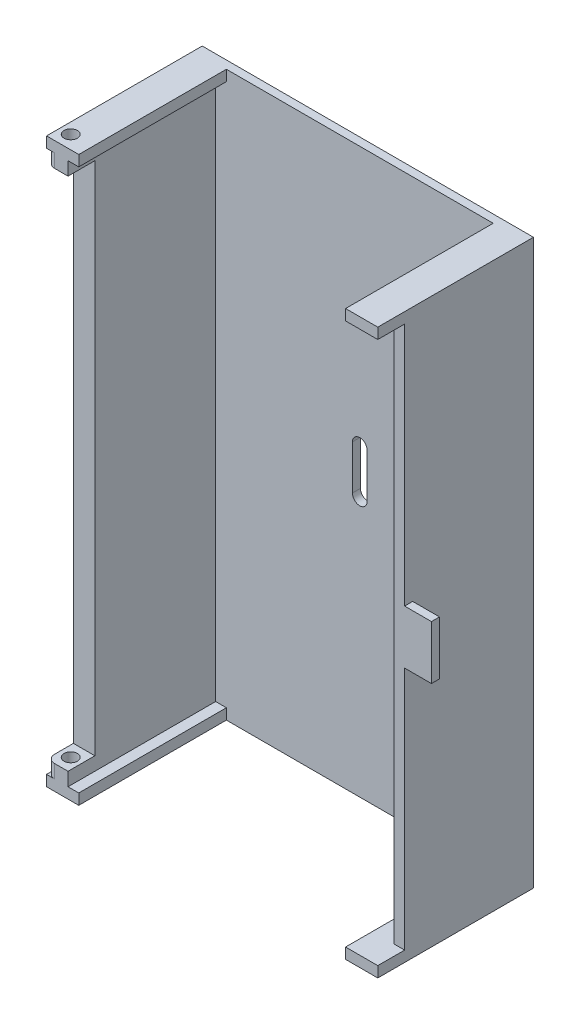
from build123d import *

# Parameters (mm, degrees)
SKETCH_2_W               = 123.4
SKETCH_2_H               = 210
EXTRUDE_2_DEPTH          = 3
EXTRUDE_5_DEPTH          = 4
EXTRUDE_START            = -4
EXTRUDE_6_DEPTH          = 4
EXTRUDE_8_DEPTH          = 8
CUT_EXTRUDE_1_DEPTH      = 205
CUT_EXTRUDE_1_DEPTH_BACK = 243.711170942
SKETCH_8_R               = 2.5
FILLET_1_R               = 3
SKETCH_10_W              = 4
SKETCH_10_H              = 202
EXTRUDE_9_DEPTH          = 45
CUT_EXTRUDE_2_DEPTH      = 182.404830421
SKETCH_12_W              = 3
SKETCH_12_H              = 20
EXTRUDE_10_DEPTH         = 10
CUT_EXTRUDE_3_REACH      = 254.984
SKETCH_13_W              = 99.4
SKETCH_13_H              = 144.727282118
SKETCH_13_W_2            = 205.501958082
SKETCH_13_H_2            = 63.361365512


with BuildPart() as part:
    # 草圖2 → 填料-伸長2 (new body)
    with BuildSketch(Plane.XY):
        with Locations((2.95, -15)):
            Rectangle(SKETCH_2_W, SKETCH_2_H)
    extrude(amount=EXTRUDE_2_DEPTH)

    # 草圖4 → 填料-伸長5 (add)
    with BuildSketch(Plane.XZ.offset(120)):
        with BuildLine():
            Line((-58.75, 3), (-58.75, 58))
            ThreePointArc((-58.75, 58), (2.95, 119.7), (64.65, 58))
            Line((64.65, 58), (64.65, 3))
            Line((64.65, 3), (-58.75, 3))
        make_face()
    extrude(amount=-EXTRUDE_5_DEPTH)

    # 草圖5 → 填料-伸長6 (add)
    with BuildSketch(Plane(origin=(0, 90, 0), x_dir=(1, 0, 0), z_dir=(0, 1, 0)).offset(EXTRUDE_START)):
        with BuildLine():
            Line((-58.75, -3), (-58.75, -58))
            ThreePointArc((-58.75, -58), (2.95, -119.7), (64.65, -58))
            Line((64.65, -58), (64.65, -3))
            Line((64.65, -3), (-58.75, -3))
        make_face()
    extrude(amount=EXTRUDE_6_DEPTH)

    # 草圖7 → 填料-伸長8 (add)
    with BuildSketch(Plane.ZY.offset(58.75)):
        Polygon((3, 86), (58, 86), (58, 81), (48, 81), (48, -111), (58, -111), (58, -116), (3, -116), align=None)
    extrude(amount=-EXTRUDE_8_DEPTH)

    # 草圖8 → 除料-伸長1 (cut, two sides: drawn at the far end of the back side and taken through both)
    with BuildSketch(Plane.XZ.offset(-81).offset(-CUT_EXTRUDE_1_DEPTH_BACK)):
        with Locations(Location((-54.75, 53, 0), (0, 0, 90))):
            Circle(SKETCH_8_R)
    extrude(amount=CUT_EXTRUDE_1_DEPTH + CUT_EXTRUDE_1_DEPTH_BACK, mode=Mode.SUBTRACT)

    # 圓角1
    fillet_1_edges = [part.edges().sort_by_distance(p)[0] for p in [
        (-58.75, -113.5, 58),
        (-58.75, 83.5, 58),
    ]]
    fillet(fillet_1_edges, radius=FILLET_1_R)

    # 草圖10 → 填料-伸長9 (add)
    with BuildSketch(Plane.XY.offset(3)):
        with Locations((62.65, -15)):
            Rectangle(SKETCH_10_W, SKETCH_10_H)
    extrude(amount=EXTRUDE_9_DEPTH)

    # 草圖11 → 除料-伸長2 (cut, through all)
    with BuildSketch(Plane(origin=(0, 0, 0), x_dir=(-1, 0, 0), z_dir=(0, 0, -1))):
        with BuildLine():
            Line((-0.2, -6.75), (-0.2, -23.25))
            ThreePointArc((-0.2, -23.25), (-2.95, -26), (-5.7, -23.25))
            Line((-5.7, -23.25), (-5.7, -6.75))
            ThreePointArc((-5.7, -6.75), (-2.95, -4), (-0.2, -6.75))
        make_face()
    extrude(amount=-CUT_EXTRUDE_2_DEPTH, mode=Mode.SUBTRACT)

    # 草圖12 → 填料-伸長10 (add)
    with BuildSketch(Plane(origin=(64.65, 0, 0), x_dir=(0, 0, -1), z_dir=(1, 0, 0))):
        with Locations((-46.5, -15)):
            Rectangle(SKETCH_12_W, SKETCH_12_H)
    extrude(amount=EXTRUDE_10_DEPTH)

    # 除料-伸長3: up to this face of the body (flat: up to its plane)
    cut_extrude_3_end = Plane(part.part.faces().sort_by_distance((3.036368919, -120, 54.121907078))[0])
    # 草圖13 → 除料-伸長3 (cut, up to the picked face)
    with BuildSketch(Plane(origin=(0, 90, 0), x_dir=(1, 0, 0), z_dir=(0, 1, 0)), mode=Mode.PRIVATE) as cut_extrude_3_sk1:
        with Locations((2.95, -75.363641059)):
            Rectangle(SKETCH_13_W, SKETCH_13_H)
    cut_extrude_3_tool1 = split(extrude(cut_extrude_3_sk1.sketch, amount=-CUT_EXTRUDE_3_REACH, mode=Mode.PRIVATE), bisect_by=cut_extrude_3_end, keep=Keep.BOTH, mode=Mode.PRIVATE)
    # 草圖13 → 除料-伸長3 (cut, up to the picked face)
    with BuildSketch(Plane(origin=(0, 90, 0), x_dir=(1, 0, 0), z_dir=(0, 1, 0)), mode=Mode.PRIVATE) as cut_extrude_3_sk2:
        with Locations((2.95, -89.680682756)):
            Rectangle(SKETCH_13_W_2, SKETCH_13_H_2)
    cut_extrude_3_tool2 = split(extrude(cut_extrude_3_sk2.sketch, amount=-CUT_EXTRUDE_3_REACH, mode=Mode.PRIVATE), bisect_by=cut_extrude_3_end, keep=Keep.BOTH, mode=Mode.PRIVATE)
    add(cut_extrude_3_tool1.solids().sort_by(Axis((2.95, 90, 75.363641), (0, -1, 0)))[0], mode=Mode.SUBTRACT)
    add(cut_extrude_3_tool2.solids().sort_by(Axis((2.95, 90, 89.680683), (0, -1, 0)))[0], mode=Mode.SUBTRACT)


solid = part.part
